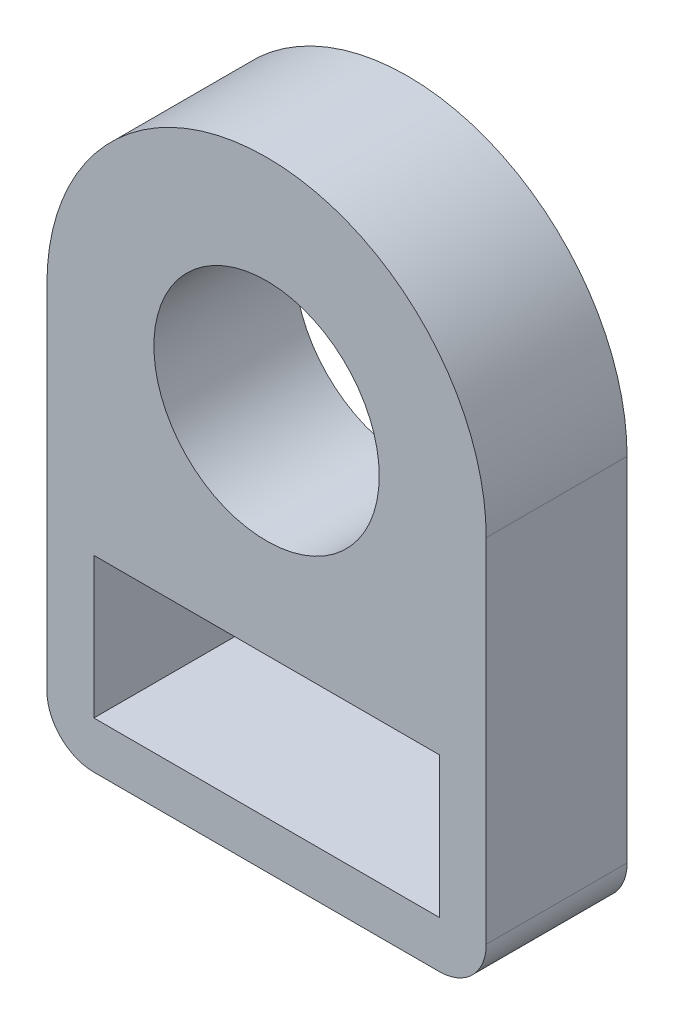
from build123d import *

# Parameters (mm, degrees)
SKETCH1_R           = 12
SKETCH1_W           = 36.78
SKETCH1_H           = 15
BOSS_EXTRUDE1_DEPTH = 15


with BuildPart() as part:
    # Sketch1 → Boss-Extrude1 (new body)
    with BuildSketch(Plane.XY):
        with BuildLine():
            Line((-18.39, -12.5), (18.390366936, -12.5))
            ThreePointArc((18.390366936, -12.5), (21.932962966, -11.028457647), (23.390326957, -7.480005346))
            Line((23.390326957, -7.480005346), (23.390326957, 30.02))
            ThreePointArc((23.390326957, 30.02), (0.000163479, 53.410163479), (-23.39, 30.02))
            Line((-23.39, 30.02), (-23.39, -7.5))
            ThreePointArc((-23.39, -7.5), (-21.925533906, -11.035533906), (-18.39, -12.5))
        make_face()
        with Locations((0, 30.02)):
            Circle(SKETCH1_R, mode=Mode.SUBTRACT)
        Rectangle(SKETCH1_W, SKETCH1_H, mode=Mode.SUBTRACT)
    extrude(amount=BOSS_EXTRUDE1_DEPTH)


solid = part.part
